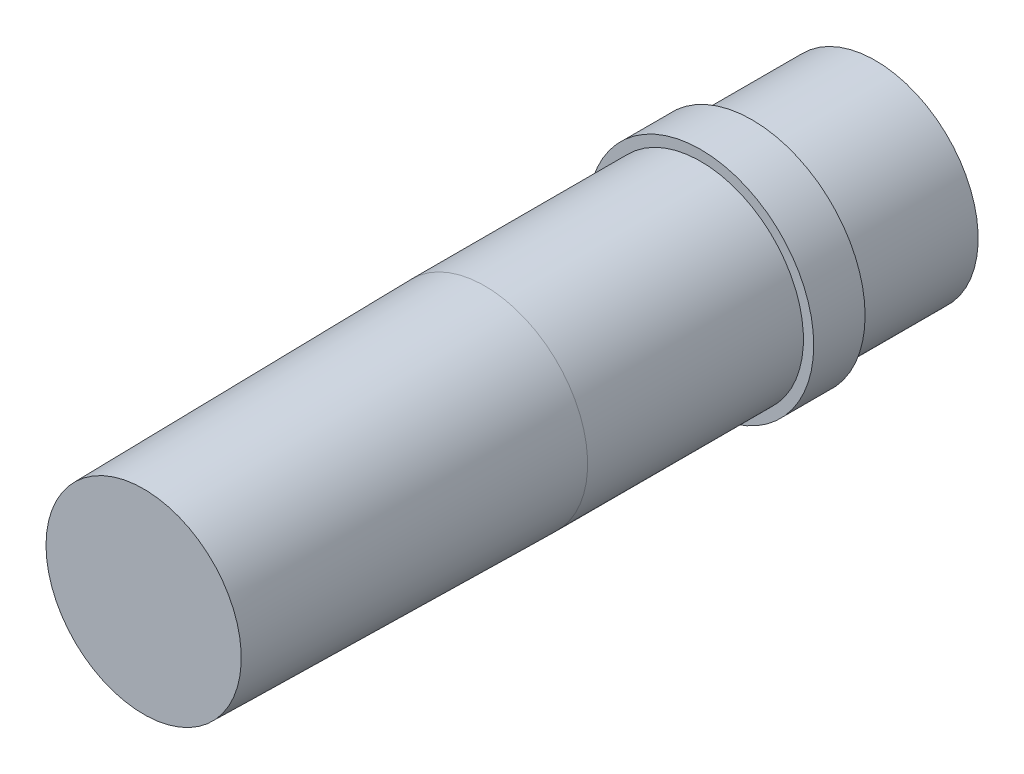
from build123d import *

# Parameters (mm, degrees)
SKETCH2_R          = 0.425
CUT_EXTRUDE1_DEPTH = 1.5


with BuildPart() as part:
    # Sketch1 → Revolve1 (revolve)
    with BuildSketch(Plane(origin=(0, 0, 0), x_dir=(1, 0, 0), z_dir=(0, 1, 0))):
        Polygon((0, 3.56), (-0.5, 3.56), (-0.5, 2.96), (-0.55, 2.96), (-0.55, 2.71), (-0.5, 2.71), (-0.5, 1.66), (-0.475, 0), (0, 0), align=None)
    revolve(axis=Axis((0, 0, -1.599810873), (0, 0, 1)))

    # Sketch2 → Cut-Extrude1 (cut)
    with BuildSketch(Plane(origin=(0, 0, -3.56), x_dir=(-1, 0, 0), z_dir=(0, 0, -1))):
        Circle(SKETCH2_R)
    extrude(amount=-CUT_EXTRUDE1_DEPTH, mode=Mode.SUBTRACT)


solid = part.part
